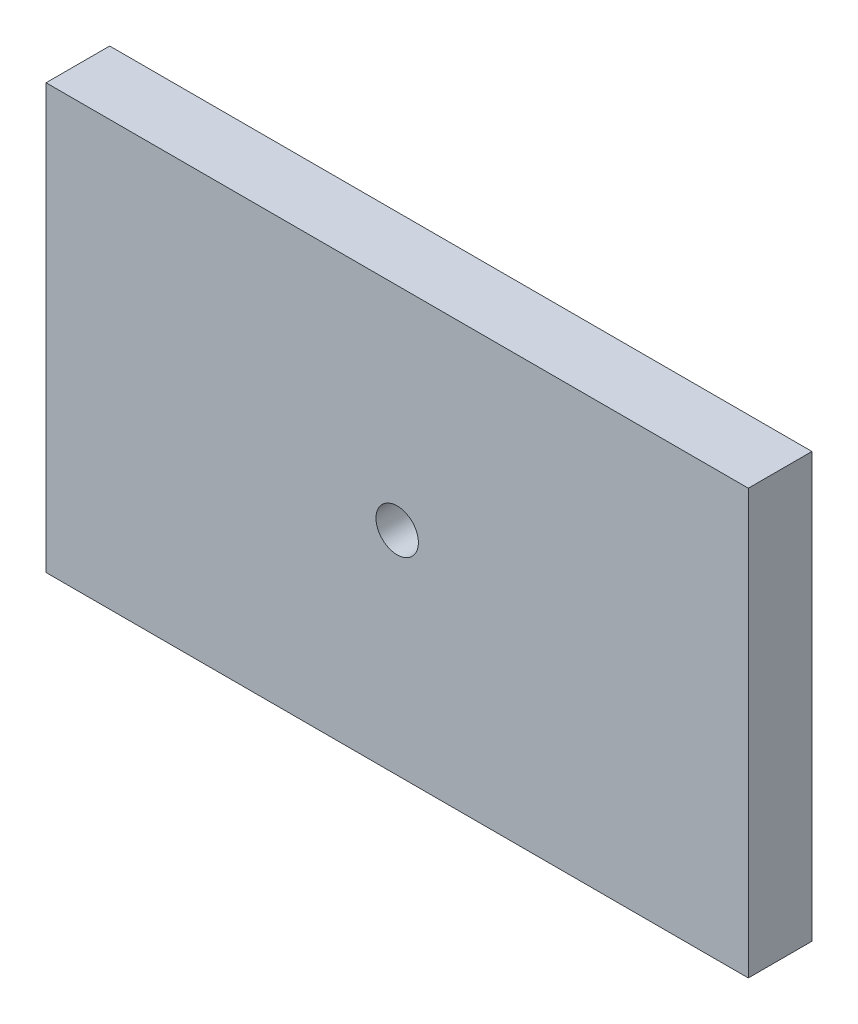
from build123d import *

# Parameters (mm, degrees)
CROQUIS1_W              = 33.11
CROQUIS1_H              = 20
CROQUIS1_R              = 1
SALIENTE_EXTRUIR1_DEPTH = 3


with BuildPart() as part:
    # Croquis1 → Saliente-Extruir1 (new body)
    with BuildSketch(Plane.XY):
        Rectangle(CROQUIS1_W, CROQUIS1_H)
        Circle(CROQUIS1_R, mode=Mode.SUBTRACT)
    extrude(amount=SALIENTE_EXTRUIR1_DEPTH)


solid = part.part
